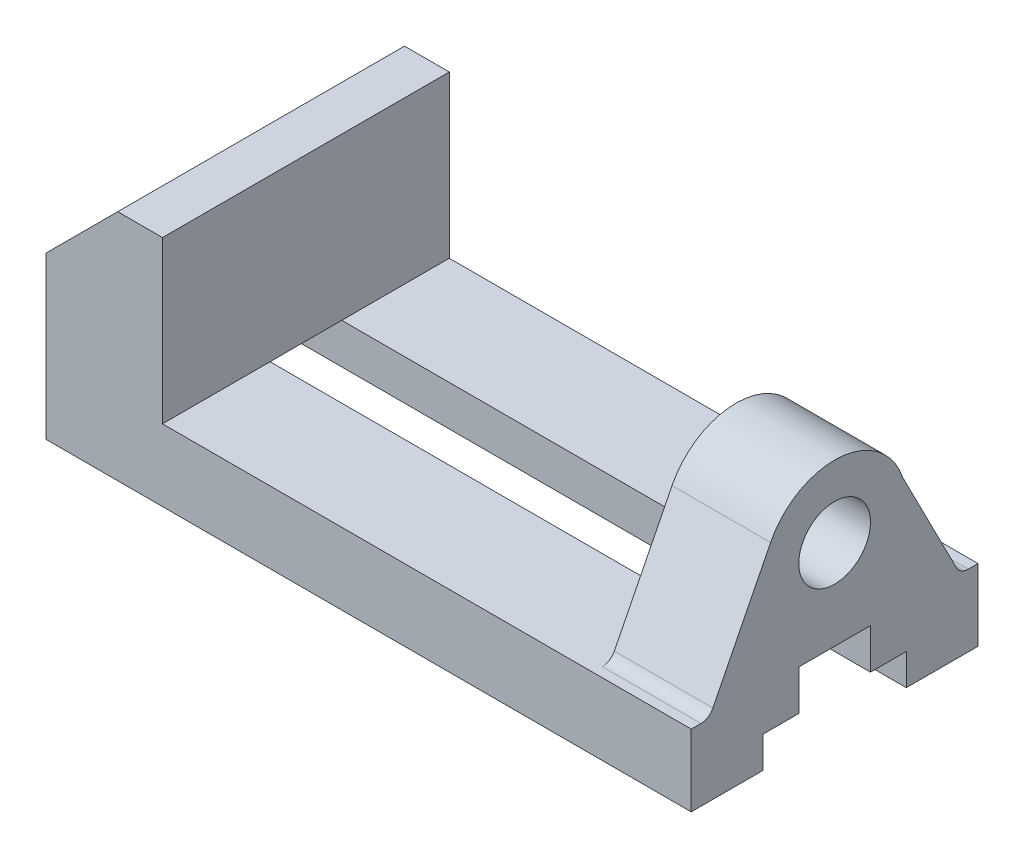
from build123d import *

# Parameters (mm, degrees)
SKETCH2_W                 = 144
SKETCH2_H                 = 52
BOSS_EXTRUDE2_DEPTH       = 64
SKETCH3_W                 = 96
SKETCH3_H                 = 36
CUT_EXTRUDE1_DEPTH        = 64
SKETCH6_R                 = 8
CUT_EXTRUDE5_DEPTH        = 64
CUT_EXTRUDE7_DEPTH        = 160.712241234
CUT_EXTRUDE8_DEPTH        = 100.779757466
FILLET1_R                 = 3
F_1_0MM_DOWEL_HOLE1_D     = 6
F_1_0MM_DOWEL_HOLE1_DEPTH = 10
F_1_0MM_DOWEL_HOLE1_TIP   = 1.732050808
F_1_0MM_DOWEL_HOLE2_D     = 6
F_1_0MM_DOWEL_HOLE2_DEPTH = 10
F_1_0MM_DOWEL_HOLE2_TIP   = 1.732050808


with BuildPart() as part:
    # Sketch2 → Boss-Extrude2 (new body)
    with BuildSketch(Plane.XY):
        Rectangle(SKETCH2_W, SKETCH2_H)
    extrude(amount=BOSS_EXTRUDE2_DEPTH)

    # Sketch3 → Cut-Extrude1 (cut)
    with BuildSketch(Plane.XY.offset(64)):
        with Locations((2, 8)):
            Rectangle(SKETCH3_W, SKETCH3_H)
    extrude(amount=-CUT_EXTRUDE1_DEPTH, mode=Mode.SUBTRACT)

    # Sketch6 → Cut-Extrude5 (cut)
    with BuildSketch(Plane(origin=(72, 0, 0), x_dir=(0, 0, -1), z_dir=(1, 0, 0))):
        Polygon((-64, 26), (-64, -10), (-60, -10), (-46.287322277, 17.202251187), (-41.852369694, 26), align=None)
        with BuildLine():
            Line((0, 26), (-22.4139537, 26))
            Line((-22.4139537, 26), (-19.003189987, 19.331823481))
            ThreePointArc((-19.003189987, 19.331823481), (-17.755283243, 17.286154301), (-16.826882915, 15.077058))
            Line((-16.826882915, 15.077058), (-4, -10))
            Line((-4, -10), (0, -10))
            Line((0, -10), (0, 26))
        make_face()
        with BuildLine():
            Line((-22.4139537, 26), (-32, 26))
            ThreePointArc((-32, 26), (-24.696205633, 24.235680098), (-19.003189987, 19.331823481))
            Line((-19.003189987, 19.331823481), (-22.4139537, 26))
        make_face()
        with BuildLine():
            Line((-41.852369694, 26), (-46.287322277, 17.202251187))
            ThreePointArc((-46.287322277, 17.202251187), (-40.389397505, 23.624170048), (-32, 26))
            Line((-32, 26), (-41.852369694, 26))
        make_face()
        with Locations((-32, 10)):
            Circle(SKETCH6_R)
    extrude(amount=-CUT_EXTRUDE5_DEPTH, mode=Mode.SUBTRACT)

    # Sketch7 → Cut-Extrude7 (cut, through all)
    with BuildSketch(Plane(origin=(72, 0, 0), x_dir=(0, 0, -1), z_dir=(1, 0, 0))):
        Polygon((-40, -10), (-40, -19), (-32, -19), (-24, -19), (-24, -10), align=None)
        Polygon((-48, -19), (-48, -26), (-16, -26), (-16, -19), (-24, -19), (-32, -19), (-40, -19), align=None)
    extrude(amount=-CUT_EXTRUDE7_DEPTH, mode=Mode.SUBTRACT)

    # Sketch8 → Cut-Extrude8 (cut, through all)
    with BuildSketch(Plane.XY.offset(64)):
        Polygon((-72, 26), (-56, 26), (-72, 10), align=None)
    extrude(amount=-CUT_EXTRUDE8_DEPTH, mode=Mode.SUBTRACT)

    # Fillet1
    fillet1_edges = [part.edges().sort_by_distance(p)[0] for p in [
        (61, -10, 4),
        (61, -10, 60),
    ]]
    fillet(fillet1_edges, radius=FILLET1_R)

    # Ø1.0mm Dowel Hole1
    with Locations(Plane(origin=(-36, -26, 56), x_dir=(0, 0, -1), z_dir=(0, -1, 0))):
        with Locations((0, 0), (0, 70)):
            Hole(F_1_0MM_DOWEL_HOLE1_D / 2, depth=F_1_0MM_DOWEL_HOLE1_DEPTH)
            with Locations((0, 0, -(F_1_0MM_DOWEL_HOLE1_DEPTH + F_1_0MM_DOWEL_HOLE1_TIP / 2))):  # 120° drill point
                Cone(0, F_1_0MM_DOWEL_HOLE1_D / 2, F_1_0MM_DOWEL_HOLE1_TIP, mode=Mode.SUBTRACT)

    # Ø1.0mm Dowel Hole2
    with Locations(Plane(origin=(-36, -26, 8), x_dir=(0, 0, -1), z_dir=(0, -1, 0))):
        with Locations((0, 0), (0, 70)):
            Hole(F_1_0MM_DOWEL_HOLE2_D / 2, depth=F_1_0MM_DOWEL_HOLE2_DEPTH)
            with Locations((0, 0, -(F_1_0MM_DOWEL_HOLE2_DEPTH + F_1_0MM_DOWEL_HOLE2_TIP / 2))):  # 120° drill point
                Cone(0, F_1_0MM_DOWEL_HOLE2_D / 2, F_1_0MM_DOWEL_HOLE2_TIP, mode=Mode.SUBTRACT)


solid = part.part
